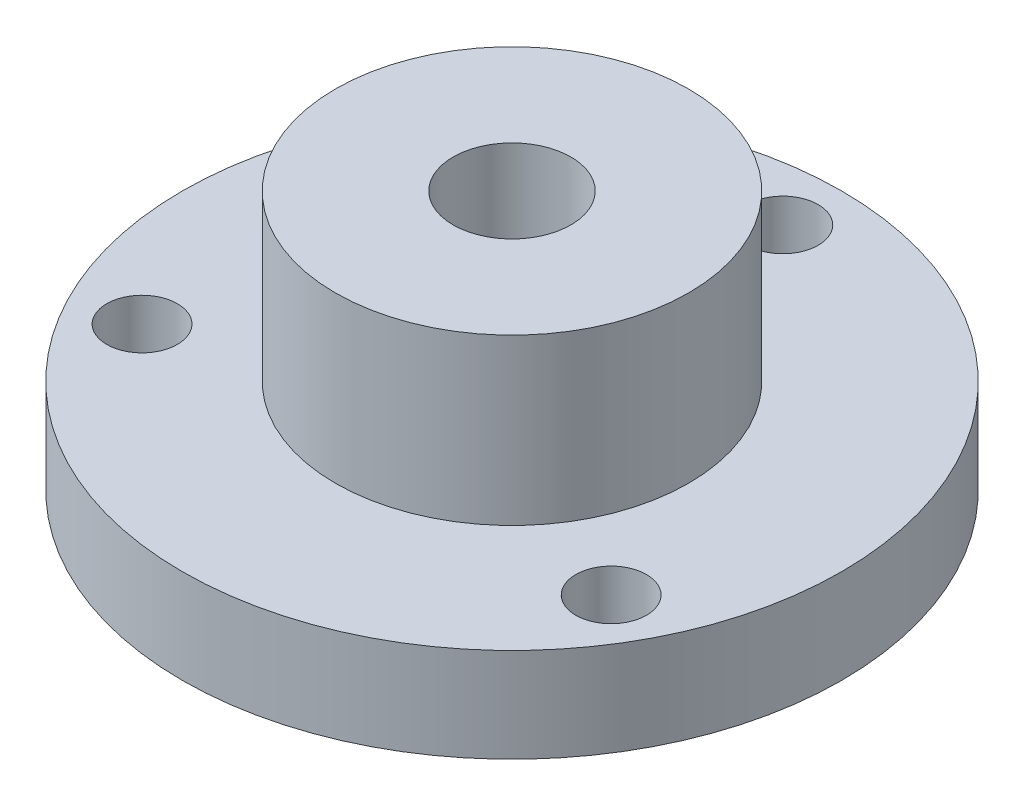
from build123d import *

# Parameters (mm, degrees)
SKETCH_1_R      = 14
SKETCH_1_R_2    = 1.5
EXTRUDE_1_DEPTH = 4
SKETCH_2_R      = 7.5
SKETCH_2_R_2    = 2.5
EXTRUDE_2_DEPTH = 7


with BuildPart() as part:
    # 草图1 → 凸台-拉伸1 (new body)
    with BuildSketch(Plane(origin=(0, 0, 0), x_dir=(1, 0, 0), z_dir=(0, 1, 0))):
        with Locations(Location((0, 0, 0), (0, 0, 270))):
            Circle(SKETCH_1_R)
        with Locations(Location((0, 11.5, 0), (0, 0, 270))):
            Circle(SKETCH_1_R_2, mode=Mode.SUBTRACT)
        with Locations(Location((9.959292144, -5.75, 0), (0, 0, 270))):
            Circle(SKETCH_1_R_2, mode=Mode.SUBTRACT)
        with Locations(Location((-9.959292144, -5.75, 0), (0, 0, 270))):
            Circle(SKETCH_1_R_2, mode=Mode.SUBTRACT)
    extrude(amount=EXTRUDE_1_DEPTH)

    # 草图2 → 凸台-拉伸2 (add)
    with BuildSketch(Plane(origin=(0, 4, 0), x_dir=(1, 0, 0), z_dir=(0, 1, 0))):
        with Locations(Location((0, 0, 0), (0, 0, 270))):
            Circle(SKETCH_2_R)
        with Locations(Location((0, 0, 0), (0, 0, 270))):
            Circle(SKETCH_2_R_2, mode=Mode.SUBTRACT)
    extrude(amount=EXTRUDE_2_DEPTH)


solid = part.part
